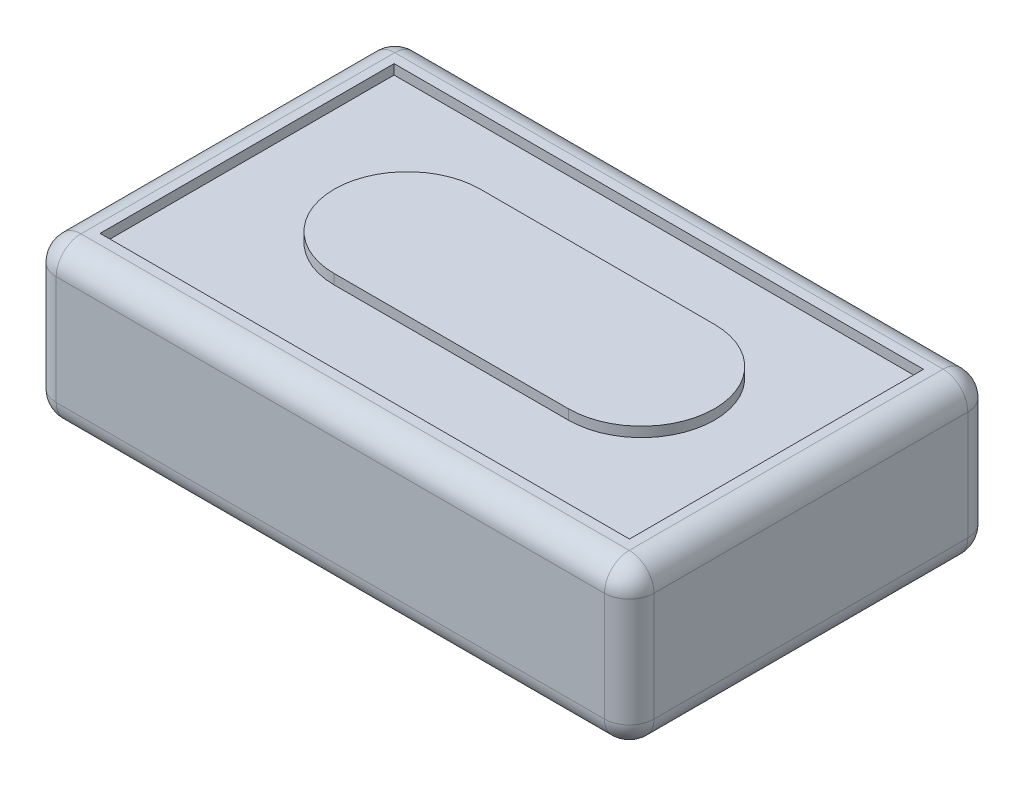
from build123d import *

# Parameters (mm, degrees)
SKETCH_1_W          = 120.704131687
SKETCH_1_H          = 73.359986831
EXTRUDE_1_DEPTH     = 32
FILLET_4_R          = 5
SKETCH_2_W          = 103.308329398
SKETCH_2_H          = 57.020562217
EXTRUDE_2_DEPTH     = 1
SKETCH_3_W          = 106.896586693
SKETCH_3_H          = 59.364518817
CUT_EXTRUDE_1_DEPTH = 2
EXTRUDE_4_DEPTH     = 2
SKETCH_6_W          = 107.275121148
SKETCH_6_H          = 59.528469182
CUT_EXTRUDE_2_DEPTH = 26


with BuildPart() as part:
    # 草图1 → 凸台-拉伸1 (new body)
    with BuildSketch(Plane(origin=(0, 0, 0), x_dir=(1, 0, 0), z_dir=(0, 1, 0))):
        with Locations((-12.539167079, 5.976612345)):
            Rectangle(SKETCH_1_W, SKETCH_1_H)
    extrude(amount=EXTRUDE_1_DEPTH)

    # 圆角4
    fillet_4_edges = [part.edges().sort_by_distance(p)[0] for p in [
        (-12.539167078, 32, -42.656605761),
        (-72.891232922, 32, -5.976612346),
        (-12.539167078, 32, 30.70338107),
        (-72.891232922, 0, -5.976612346),
        (-12.539167078, 0, -42.656605761),
        (47.812898765, 0, -5.976612346),
        (-12.539167078, 0, 30.70338107),
        (-72.891232922, 16, 30.70338107),
        (-72.891232922, 16, -42.656605761),
        (47.812898765, 16, -42.656605761),
        (47.812898765, 16, 30.70338107),
        (47.812898765, 32, -5.976612346),
    ]]
    fillet(fillet_4_edges, radius=FILLET_4_R)

    # 草图2 → 凸台-拉伸2 (add)
    with BuildSketch(Plane(origin=(0, 32, 0), x_dir=(1, 0, 0), z_dir=(0, 1, 0))):
        with Locations((-12.689078598, 6.094786595)):
            Rectangle(SKETCH_2_W, SKETCH_2_H)
    extrude(amount=-EXTRUDE_2_DEPTH)

    # 草图3 → 切除-拉伸1 (cut)
    with BuildSketch(Plane(origin=(0, 32, 0), x_dir=(1, 0, 0), z_dir=(0, 1, 0))):
        with Locations((-12.5895853, 5.984959014)):
            Rectangle(SKETCH_3_W, SKETCH_3_H)
    extrude(amount=-CUT_EXTRUDE_1_DEPTH, mode=Mode.SUBTRACT)

    # 草图5 → 凸台-拉伸4 (add)
    with BuildSketch(Plane(origin=(0, 30, 0), x_dir=(1, 0, 0), z_dir=(0, 1, 0))):
        with BuildLine():
            Line((-35.374881663, 22.419896032), (11.907439302, 22.419896032))
            ThreePointArc((11.907439302, 22.419896032), (26.657556761, 7.669778573), (11.907439302, -7.080338886))
            Line((11.907439302, -7.080338886), (-35.374881663, -7.080338886))
            ThreePointArc((-35.374881663, -7.080338886), (-50.124999122, 7.669778573), (-35.374881663, 22.419896032))
        make_face()
    extrude(amount=EXTRUDE_4_DEPTH)

    # 草图6 → 切除-拉伸2 (cut)
    with BuildSketch(Plane.XZ):
        with Locations((-12.51647611, -5.961067915)):
            Rectangle(SKETCH_6_W, SKETCH_6_H)
    extrude(amount=-CUT_EXTRUDE_2_DEPTH, mode=Mode.SUBTRACT)


solid = part.part
